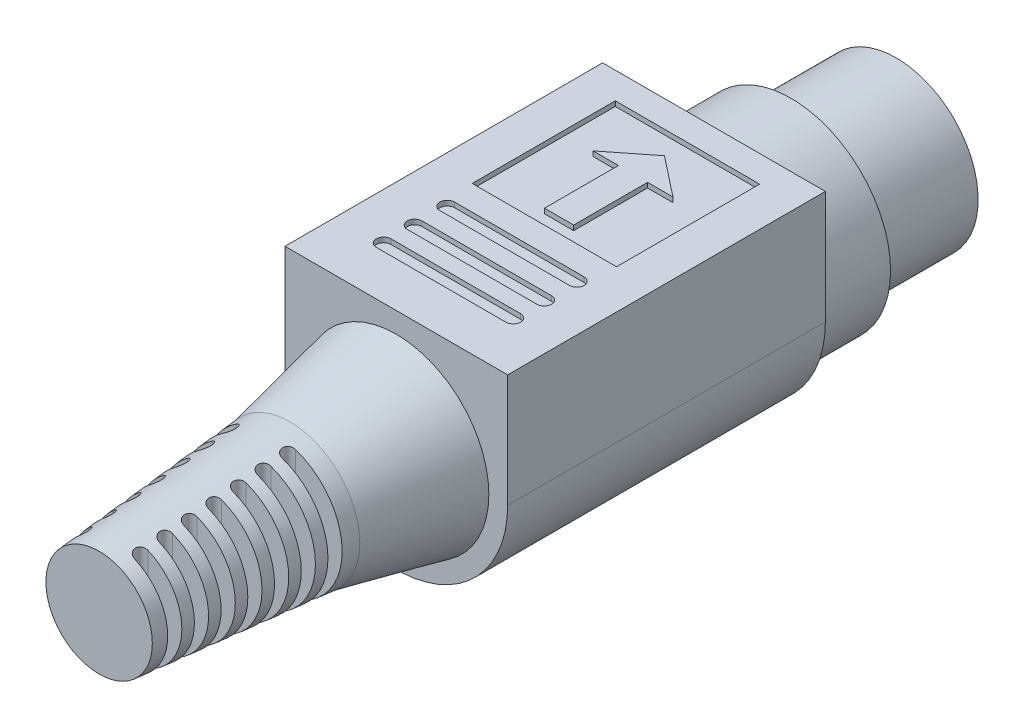
from build123d import *

# Parameters (mm, degrees)
ESBO_O1_R                         = 5
ESBO_O1_R_2                       = 4.5
RESSALTO_EXTRUS_O1_DEPTH          = 6.43
ESBO_O2_R                         = 6.08
RESSALTO_EXTRUS_O2_DEPTH          = 4.7
RESSALTO_EXTRUS_O3_DEPTH          = 19.4
ESBO_O4_R                         = 5.65
RESSALTO_EXTRUS_O4_DEPTH          = 6.5
RESSALTO_EXTRUS_O4_TAPER          = 12
ESBO_O5_R                         = 4.268382349
RESSALTO_EXTRUS_O5_DEPTH          = 11.65
RESSALTO_EXTRUS_O5_TAPER          = 5
CORTE_EXTRUS_O1_DEPTH             = 5.825
ESBO_O7_W                         = 8.813724876
ESBO_O7_H                         = 8.738143717
CORTE_EXTRUS_O2_DEPTH             = 0.3
ESBO_O8_R                         = 0.75
RESSALTO_EXTRUS_O6_DEPTH          = 5.5
DOMO1_FACE_RADIUS                 = 0.75
DOMO1_HEIGHT                      = 0.75
PADR_O_LINEAR1_COUNT              = 2
PADR_O_LINEAR1_PITCH              = 3
PADR_O_LINEAR1_COUNT_DIR2         = 2
PADR_O_LINEAR1_PITCH_DIR2         = 3
PADR_O_LINEAR1_COPY_1_FACE_RADIUS = 0.75
PADR_O_LINEAR1_COPY_1_HEIGHT      = 0.75
PADR_O_LINEAR1_COPY_2_FACE_RADIUS = 0.75
PADR_O_LINEAR1_COPY_2_HEIGHT      = 0.75
PADR_O_LINEAR1_COPY_3_FACE_RADIUS = 0.75
PADR_O_LINEAR1_COPY_3_HEIGHT      = 0.75


with BuildPart() as part:
    # Esboço1 → Ressalto-extrusão1 (new body)
    with BuildSketch(Plane.XY):
        with Locations(Location((0, 0, 0), (0, 0, 180))):
            Circle(ESBO_O1_R)
        with Locations(Location((0, 0, 0), (0, 0, 180))):
            Circle(ESBO_O1_R_2, mode=Mode.SUBTRACT)
    extrude(amount=RESSALTO_EXTRUS_O1_DEPTH)

    # Esboço2 → Ressalto-extrusão2 (add)
    with BuildSketch(Plane.XY.offset(6.43)):
        Circle(ESBO_O2_R)
    extrude(amount=RESSALTO_EXTRUS_O2_DEPTH)

    # Esboço3 → Ressalto-extrusão3 (add)
    with BuildSketch(Plane.XY.offset(11.13)):
        with BuildLine():
            Line((6.8, 6.9), (-6.8, 6.9))
            Line((-6.8, 6.9), (-6.8, 0))
            ThreePointArc((-6.8, 0), (0, -6.8), (6.8, 0))
            Line((6.8, 0), (6.8, 6.9))
        make_face()
    extrude(amount=RESSALTO_EXTRUS_O3_DEPTH)

    # Esboço4 → Ressalto-extrusão4 (add)
    with BuildSketch(Plane.XY.offset(30.53)):
        Circle(ESBO_O4_R)
    extrude(amount=RESSALTO_EXTRUS_O4_DEPTH, taper=RESSALTO_EXTRUS_O4_TAPER)

    # Esboço5 → Ressalto-extrusão5 (add)
    with BuildSketch(Plane.XY.offset(37.03)):
        Circle(ESBO_O5_R)
    extrude(amount=RESSALTO_EXTRUS_O5_DEPTH, taper=RESSALTO_EXTRUS_O5_TAPER)

    # Esboço6 → Corte-extrusão1 (cut, symmetric)
    with BuildSketch(Plane(origin=(0, 0, 0), x_dir=(1, 0, 0), z_dir=(0, 1, 0))):
        with BuildLine():
            Line((-7.675666907, -38.02098143), (-2.266906807, -38.02098143))
            ThreePointArc((-2.266906807, -38.02098143), (-1.869203858, -38.418684379), (-2.266906807, -38.816387328))
            Line((-2.266906807, -38.816387328), (-7.675666907, -38.816387328))
            ThreePointArc((-7.675666907, -38.816387328), (-8.073369856, -38.418684379), (-7.675666907, -38.02098143))
        make_face()
        with BuildLine():
            Line((1.324333093, -38.02098143), (6.733093193, -38.02098143))
            ThreePointArc((6.733093193, -38.02098143), (7.130796142, -38.418684379), (6.733093193, -38.816387328))
            Line((6.733093193, -38.816387328), (1.324333093, -38.816387328))
            ThreePointArc((1.324333093, -38.816387328), (0.926630144, -38.418684379), (1.324333093, -38.02098143))
        make_face()
        with BuildLine():
            Line((1.324333093, -39.52098143), (6.733093193, -39.52098143))
            ThreePointArc((6.733093193, -39.52098143), (7.130796142, -39.918684379), (6.733093193, -40.316387328))
            Line((6.733093193, -40.316387328), (1.324333093, -40.316387328))
            ThreePointArc((1.324333093, -40.316387328), (0.926630144, -39.918684379), (1.324333093, -39.52098143))
        make_face()
        with BuildLine():
            Line((1.324333093, -41.02098143), (6.733093193, -41.02098143))
            ThreePointArc((6.733093193, -41.02098143), (7.130796142, -41.418684379), (6.733093193, -41.816387328))
            Line((6.733093193, -41.816387328), (1.324333093, -41.816387328))
            ThreePointArc((1.324333093, -41.816387328), (0.926630144, -41.418684379), (1.324333093, -41.02098143))
        make_face()
        with BuildLine():
            Line((1.324333093, -42.52098143), (6.733093193, -42.52098143))
            ThreePointArc((6.733093193, -42.52098143), (7.130796142, -42.918684379), (6.733093193, -43.316387328))
            Line((6.733093193, -43.316387328), (1.324333093, -43.316387328))
            ThreePointArc((1.324333093, -43.316387328), (0.926630144, -42.918684379), (1.324333093, -42.52098143))
        make_face()
        with BuildLine():
            Line((1.324333093, -44.02098143), (6.733093193, -44.02098143))
            ThreePointArc((6.733093193, -44.02098143), (7.130796142, -44.418684379), (6.733093193, -44.816387328))
            Line((6.733093193, -44.816387328), (1.324333093, -44.816387328))
            ThreePointArc((1.324333093, -44.816387328), (0.926630144, -44.418684379), (1.324333093, -44.02098143))
        make_face()
        with BuildLine():
            Line((1.324333093, -45.52098143), (6.733093193, -45.52098143))
            ThreePointArc((6.733093193, -45.52098143), (7.130796142, -45.918684379), (6.733093193, -46.316387328))
            Line((6.733093193, -46.316387328), (1.324333093, -46.316387328))
            ThreePointArc((1.324333093, -46.316387328), (0.926630144, -45.918684379), (1.324333093, -45.52098143))
        make_face()
        with BuildLine():
            Line((1.324333093, -47.02098143), (6.733093193, -47.02098143))
            ThreePointArc((6.733093193, -47.02098143), (7.130796142, -47.418684379), (6.733093193, -47.816387328))
            Line((6.733093193, -47.816387328), (1.324333093, -47.816387328))
            ThreePointArc((1.324333093, -47.816387328), (0.926630144, -47.418684379), (1.324333093, -47.02098143))
        make_face()
        with BuildLine():
            Line((-7.675666907, -39.52098143), (-2.266906807, -39.52098143))
            ThreePointArc((-2.266906807, -39.52098143), (-1.869203858, -39.918684379), (-2.266906807, -40.316387328))
            Line((-2.266906807, -40.316387328), (-7.675666907, -40.316387328))
            ThreePointArc((-7.675666907, -40.316387328), (-8.073369856, -39.918684379), (-7.675666907, -39.52098143))
        make_face()
        with BuildLine():
            Line((-7.675666907, -41.02098143), (-2.266906807, -41.02098143))
            ThreePointArc((-2.266906807, -41.02098143), (-1.869203858, -41.418684379), (-2.266906807, -41.816387328))
            Line((-2.266906807, -41.816387328), (-7.675666907, -41.816387328))
            ThreePointArc((-7.675666907, -41.816387328), (-8.073369856, -41.418684379), (-7.675666907, -41.02098143))
        make_face()
        with BuildLine():
            Line((-7.675666907, -42.52098143), (-2.266906807, -42.52098143))
            ThreePointArc((-2.266906807, -42.52098143), (-1.869203858, -42.918684379), (-2.266906807, -43.316387328))
            Line((-2.266906807, -43.316387328), (-7.675666907, -43.316387328))
            ThreePointArc((-7.675666907, -43.316387328), (-8.073369856, -42.918684379), (-7.675666907, -42.52098143))
        make_face()
        with BuildLine():
            Line((-7.675666907, -44.02098143), (-2.266906807, -44.02098143))
            ThreePointArc((-2.266906807, -44.02098143), (-1.869203858, -44.418684379), (-2.266906807, -44.816387328))
            Line((-2.266906807, -44.816387328), (-7.675666907, -44.816387328))
            ThreePointArc((-7.675666907, -44.816387328), (-8.073369856, -44.418684379), (-7.675666907, -44.02098143))
        make_face()
        with BuildLine():
            Line((-7.675666907, -45.52098143), (-2.266906807, -45.52098143))
            ThreePointArc((-2.266906807, -45.52098143), (-1.869203858, -45.918684379), (-2.266906807, -46.316387328))
            Line((-2.266906807, -46.316387328), (-7.675666907, -46.316387328))
            ThreePointArc((-7.675666907, -46.316387328), (-8.073369856, -45.918684379), (-7.675666907, -45.52098143))
        make_face()
        with BuildLine():
            Line((-7.675666907, -47.02098143), (-2.266906807, -47.02098143))
            ThreePointArc((-2.266906807, -47.02098143), (-1.869203858, -47.418684379), (-2.266906807, -47.816387328))
            Line((-2.266906807, -47.816387328), (-7.675666907, -47.816387328))
            ThreePointArc((-7.675666907, -47.816387328), (-8.073369856, -47.418684379), (-7.675666907, -47.02098143))
        make_face()
    extrude(amount=CORTE_EXTRUS_O1_DEPTH, both=True, mode=Mode.SUBTRACT)

    # Esboço7 → Corte-extrusão2 (cut)
    # profile 1 of 4: a face of its own
    with BuildSketch(Plane(origin=(0, 6.9, 0), x_dir=(1, 0, 0), z_dir=(0, 1, 0))):
        with Locations((0, -17.120191105)):
            Rectangle(ESBO_O7_W, ESBO_O7_H)
        Polygon((-0.890199437, -16.077223612), (-2.438061787, -16.077223612), (0, -14.154414277), (2.438061787, -16.077223612), (0.890199437, -16.077223612), (0.890199437, -20.590669012), (-0.890199437, -20.590669012), align=None, mode=Mode.SUBTRACT)
    # profile 2 of 4: a face of its own
    with BuildSketch(Plane(origin=(0, 6.9, 0), x_dir=(1, 0, 0), z_dir=(0, 1, 0))):
        with BuildLine():
            Line((-3.956439822, -23.013244314), (3.956439822, -23.013244314))
            ThreePointArc((3.956439822, -23.013244314), (4.406862438, -23.46366693), (3.956439822, -23.914089546))
            Line((3.956439822, -23.914089546), (-3.956439822, -23.914089546))
            ThreePointArc((-3.956439822, -23.914089546), (-4.406862438, -23.46366693), (-3.956439822, -23.013244314))
        make_face()
    # profile 3 of 4: a face of its own
    with BuildSketch(Plane(origin=(0, 6.9, 0), x_dir=(1, 0, 0), z_dir=(0, 1, 0))):
        with BuildLine():
            Line((-3.956439822, -25.004480722), (3.956439822, -25.004480722))
            ThreePointArc((3.956439822, -25.004480722), (4.406862438, -25.454903337), (3.956439822, -25.905325953))
            Line((3.956439822, -25.905325953), (-3.956439822, -25.905325953))
            ThreePointArc((-3.956439822, -25.905325953), (-4.406862438, -25.454903337), (-3.956439822, -25.004480722))
        make_face()
    # profile 4 of 4: a face of its own
    with BuildSketch(Plane(origin=(0, 6.9, 0), x_dir=(1, 0, 0), z_dir=(0, 1, 0))):
        with BuildLine():
            Line((-3.956439822, -26.898188746), (3.956439822, -26.898188746))
            ThreePointArc((3.956439822, -26.898188746), (4.406862438, -27.348611362), (3.956439822, -27.799033978))
            Line((3.956439822, -27.799033978), (-3.956439822, -27.799033978))
            ThreePointArc((-3.956439822, -27.799033978), (-4.406862438, -27.348611362), (-3.956439822, -26.898188746))
        make_face()
    extrude(amount=-CORTE_EXTRUS_O2_DEPTH, mode=Mode.SUBTRACT)

    # Esboço8 → Ressalto-extrusão6 (add)
    with BuildSketch(Plane(origin=(0, 0, 6.43), x_dir=(-1, 0, 0), z_dir=(0, 0, -1))):
        with Locations(Location((-1.5, 1.5, 0), (0, 0, 180))):
            Circle(ESBO_O8_R)
    ressalto_extrus_o6 = extrude(amount=RESSALTO_EXTRUS_O6_DEPTH)

    # Domo1: a dome of height H over a round flat face of radius A is a cap of a sphere of radius (A * A + H * H) / (2 * H)
    domo1_r = (DOMO1_FACE_RADIUS * DOMO1_FACE_RADIUS + DOMO1_HEIGHT * DOMO1_HEIGHT) / (2 * DOMO1_HEIGHT)
    domo1_base = Plane((1.5, 1.5, 0.93), z_dir=(0, 0, -1))
    with Locations(domo1_base.offset(DOMO1_HEIGHT - domo1_r)):
        domo1_ball = Sphere(domo1_r, mode=Mode.PRIVATE)
    add(split(domo1_ball, bisect_by=domo1_base, keep=Keep.TOP, mode=Mode.PRIVATE))

    # Padrão linear1: Ressalto-extrus_o6 2 × 2
    with Locations(*[(-i * PADR_O_LINEAR1_PITCH, -j * PADR_O_LINEAR1_PITCH_DIR2, 0) for i in range(PADR_O_LINEAR1_COUNT) for j in range(PADR_O_LINEAR1_COUNT_DIR2) if (i, j) != (0, 0)]):
        add(ressalto_extrus_o6)

    # Padrão linear1 copy 1: a dome of height H over a round flat face of radius A is a cap of a sphere of radius (A * A + H * H) / (2 * H)
    padr_o_linear1_copy_1_r = (PADR_O_LINEAR1_COPY_1_FACE_RADIUS * PADR_O_LINEAR1_COPY_1_FACE_RADIUS + PADR_O_LINEAR1_COPY_1_HEIGHT * PADR_O_LINEAR1_COPY_1_HEIGHT) / (2 * PADR_O_LINEAR1_COPY_1_HEIGHT)
    padr_o_linear1_copy_1_base = Plane((1.5, -1.5, 0.93), z_dir=(0, 0, -1))
    with Locations(padr_o_linear1_copy_1_base.offset(PADR_O_LINEAR1_COPY_1_HEIGHT - padr_o_linear1_copy_1_r)):
        padr_o_linear1_copy_1_ball = Sphere(padr_o_linear1_copy_1_r, mode=Mode.PRIVATE)
    add(split(padr_o_linear1_copy_1_ball, bisect_by=padr_o_linear1_copy_1_base, keep=Keep.TOP, mode=Mode.PRIVATE))

    # Padrão linear1 copy 2: a dome of height H over a round flat face of radius A is a cap of a sphere of radius (A * A + H * H) / (2 * H)
    padr_o_linear1_copy_2_r = (PADR_O_LINEAR1_COPY_2_FACE_RADIUS * PADR_O_LINEAR1_COPY_2_FACE_RADIUS + PADR_O_LINEAR1_COPY_2_HEIGHT * PADR_O_LINEAR1_COPY_2_HEIGHT) / (2 * PADR_O_LINEAR1_COPY_2_HEIGHT)
    padr_o_linear1_copy_2_base = Plane((-1.5, 1.5, 0.93), z_dir=(0, 0, -1))
    with Locations(padr_o_linear1_copy_2_base.offset(PADR_O_LINEAR1_COPY_2_HEIGHT - padr_o_linear1_copy_2_r)):
        padr_o_linear1_copy_2_ball = Sphere(padr_o_linear1_copy_2_r, mode=Mode.PRIVATE)
    add(split(padr_o_linear1_copy_2_ball, bisect_by=padr_o_linear1_copy_2_base, keep=Keep.TOP, mode=Mode.PRIVATE))

    # Padrão linear1 copy 3: a dome of height H over a round flat face of radius A is a cap of a sphere of radius (A * A + H * H) / (2 * H)
    padr_o_linear1_copy_3_r = (PADR_O_LINEAR1_COPY_3_FACE_RADIUS * PADR_O_LINEAR1_COPY_3_FACE_RADIUS + PADR_O_LINEAR1_COPY_3_HEIGHT * PADR_O_LINEAR1_COPY_3_HEIGHT) / (2 * PADR_O_LINEAR1_COPY_3_HEIGHT)
    padr_o_linear1_copy_3_base = Plane((-1.5, -1.5, 0.93), z_dir=(0, 0, -1))
    with Locations(padr_o_linear1_copy_3_base.offset(PADR_O_LINEAR1_COPY_3_HEIGHT - padr_o_linear1_copy_3_r)):
        padr_o_linear1_copy_3_ball = Sphere(padr_o_linear1_copy_3_r, mode=Mode.PRIVATE)
    add(split(padr_o_linear1_copy_3_ball, bisect_by=padr_o_linear1_copy_3_base, keep=Keep.TOP, mode=Mode.PRIVATE))


solid = part.part
